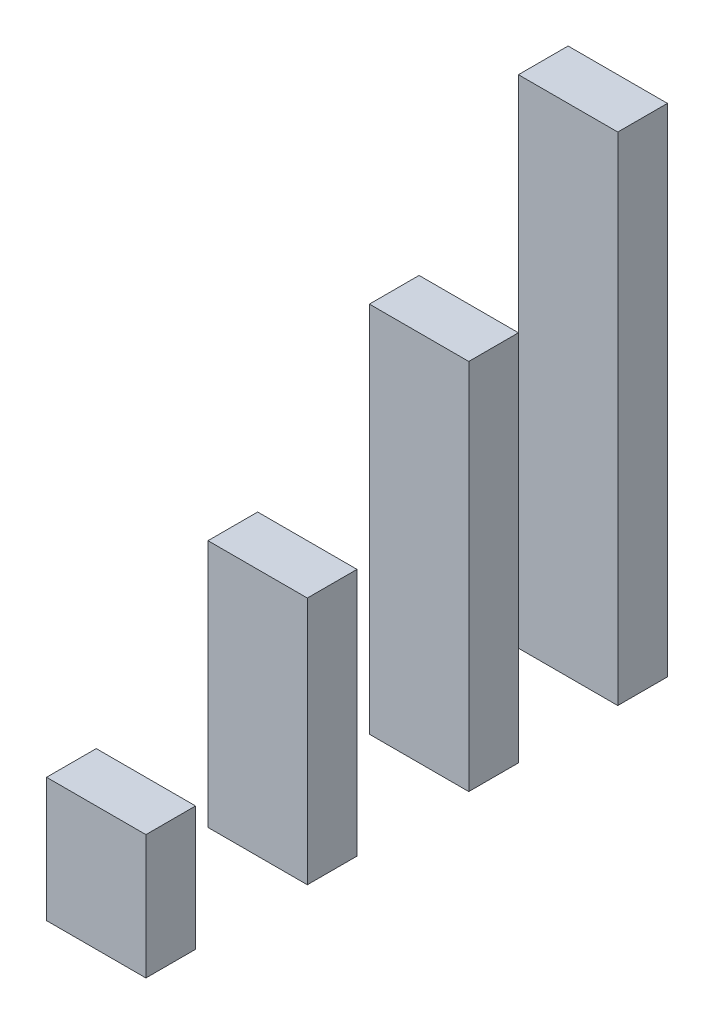
from build123d import *

# Parameters (mm, degrees)
SKETCH2_W           = 8
SKETCH2_H           = 4
BOSS_EXTRUDE1_DEPTH = 10
SKETCH3_W           = 8
SKETCH3_H           = 4
BOSS_EXTRUDE2_DEPTH = 20
SKETCH4_W           = 8
SKETCH4_H           = 4
BOSS_EXTRUDE3_DEPTH = 30
SKETCH5_W           = 8
SKETCH5_H           = 4
BOSS_EXTRUDE4_DEPTH = 40


with BuildPart() as part:
    # Sketch2 → Boss-Extrude1 (new body)
    with BuildSketch(Plane(origin=(0, 1, 0), x_dir=(1, 0, 0), z_dir=(0, 1, 0))):
        with Locations((0, -19)):
            Rectangle(SKETCH2_W, SKETCH2_H)
    extrude(amount=BOSS_EXTRUDE1_DEPTH)


with BuildPart() as body_2:
    # Sketch3 → Boss-Extrude2 (new body)
    with BuildSketch(Plane(origin=(0, 1, 0), x_dir=(1, 0, 0), z_dir=(0, 1, 0))):
        with Locations((0, -6)):
            Rectangle(SKETCH3_W, SKETCH3_H)
    extrude(amount=BOSS_EXTRUDE2_DEPTH)


with BuildPart() as body_3:
    # Sketch4 → Boss-Extrude3 (new body)
    with BuildSketch(Plane(origin=(0, 1, 0), x_dir=(1, 0, 0), z_dir=(0, 1, 0))):
        with Locations((0, 7)):
            Rectangle(SKETCH4_W, SKETCH4_H)
    extrude(amount=BOSS_EXTRUDE3_DEPTH)


with BuildPart() as body_4:
    # Sketch5 → Boss-Extrude4 (new body)
    with BuildSketch(Plane(origin=(0, 1, 0), x_dir=(1, 0, 0), z_dir=(0, 1, 0))):
        with Locations((0, 19)):
            Rectangle(SKETCH5_W, SKETCH5_H)
    extrude(amount=BOSS_EXTRUDE4_DEPTH)


solid = Compound([part.part, body_2.part, body_3.part, body_4.part])
